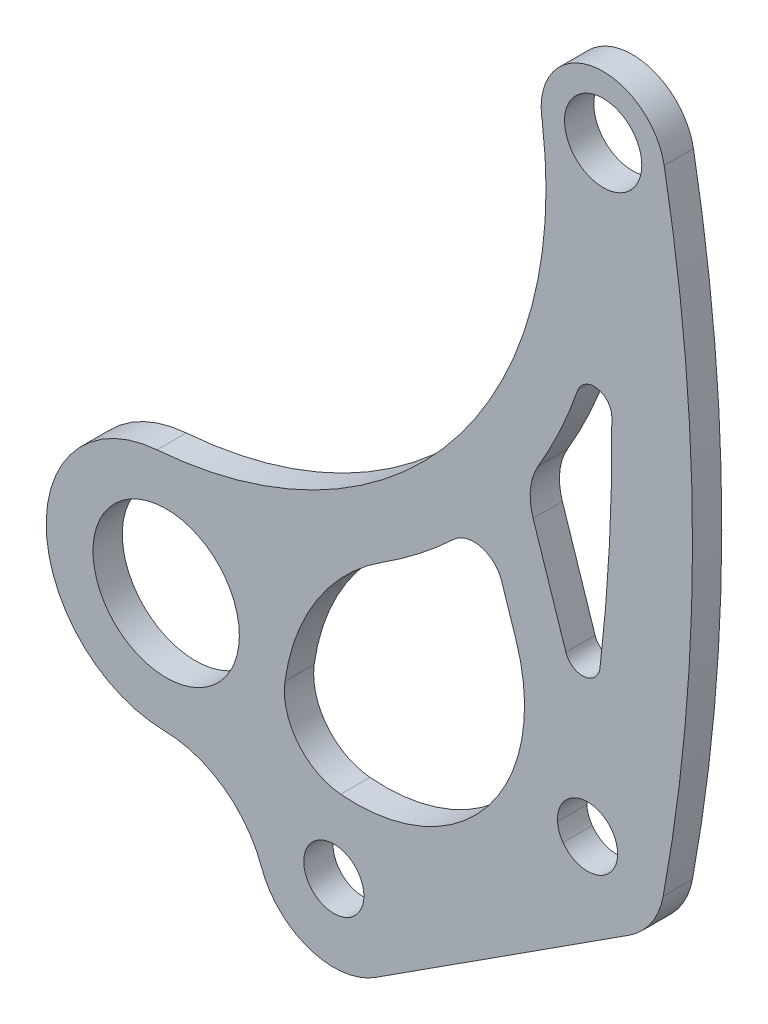
from build123d import *

# Parameters (mm, degrees)
SKETCH2_R           = 7.9375
SKETCH2_R_2         = 3.2639
SKETCH2_R_3         = 4.191
BOSS_EXTRUDE1_DEPTH = 3.175
FILLET3_R           = 1.905
FILLET4_R           = 6.35
BOSS_EXTRUDE2_START = -3.175
BOSS_EXTRUDE2_DEPTH = 3.175
CUT_EXTRUDE1_DEPTH  = 12.065
FILLET5_R           = 3.175
CUT_EXTRUDE2_DEPTH  = 93.540316773


with BuildPart() as part:
    # Sketch2 → Boss-Extrude1 (new body)
    with BuildSketch(Plane.XY):
        with BuildLine():
            Line((22.709173353, -24.74146542), (50.237344688, -7.01528789))
            ThreePointArc((50.237344688, -7.01528789), (52.649254226, -4.648236557), (53.924522204, -1.51871084))
            ThreePointArc((53.924522204, -1.51871084), (57.106411985, 32.846575037), (54.035830718, 67.22198524))
            ThreePointArc((54.035830718, 67.22198524), (46.044632155, 72.608660166), (40.859194914, 64.485436554))
            Line((40.859194914, 64.485436554), (40.833827284, 64.453346951))
            ThreePointArc((40.833827284, 64.453346951), (30.975387354, 29.729811242), (-0.998479041, 12.979150429))
            ThreePointArc((-0.998479041, 12.979150429), (-12.595568055, 3.287395871), (-7.214067166, -10.835706769))
            Line((-7.214067166, -10.835706769), (13.567787564, -24.671601284))
            ThreePointArc((13.567787564, -24.671601284), (18.128061271, -26.069833859), (22.709173353, -24.74146542))
        make_face()
        Circle(SKETCH2_R, mode=Mode.SUBTRACT)
        with Locations((18.191828664, -17.726177531)):
            Circle(SKETCH2_R_2, mode=Mode.SUBTRACT)
        with Locations((45.72, 0)):
            Circle(SKETCH2_R_2, mode=Mode.SUBTRACT)
        with BuildLine():
            Line((40.584986991, 6.617553577), (21.318666843, -5.788581474))
            Line((21.318666843, -5.788581474), (11.074870198, -6.841239387))
            ThreePointArc((11.074870198, -6.841239387), (12.976194182, 1.036190528), (9.848859751, 8.512066016))
            ThreePointArc((9.848859751, 8.512066016), (23.445327069, 14.632175726), (34.749899024, 24.354640398))
            Line((34.749899024, 24.354640398), (40.584986991, 6.617553577))
        make_face(mode=Mode.SUBTRACT)
        with BuildLine():
            ThreePointArc((47.523781163, 56.501393309), (48.257752726, 32.370804269), (45.933946154, 8.34115665))
            Line((45.933946154, 8.34115665), (38.882442516, 29.775817606))
            ThreePointArc((38.882442516, 29.775817606), (45.039190515, 42.544935267), (47.523781163, 56.501393309))
        make_face(mode=Mode.SUBTRACT)
        with Locations((47.413333333, 66.018287029)):
            Circle(SKETCH2_R_3, mode=Mode.SUBTRACT)
    extrude(amount=BOSS_EXTRUDE1_DEPTH)

    # Fillet3
    fillet3_edges = [part.edges().sort_by_distance(p)[0] for p in [
        (45.933946154, 8.34115665, 1.5875),
        (47.523781163, 56.501393309, 1.5875),
    ]]
    fillet(fillet3_edges, radius=FILLET3_R)

    # Fillet4
    fillet4_edges = [part.edges().sort_by_distance(p)[0] for p in [
        (38.882442516, 29.775817606, 1.5875),
    ]]
    fillet(fillet4_edges, radius=FILLET4_R)

    # Sketch3 → Boss-Extrude2 (add)
    with BuildSketch(Plane.XY.offset(3.175).offset(BOSS_EXTRUDE2_START)):
        with BuildLine():
            ThreePointArc((37.967247274, 14.574773228), (38.850624387, 9.974362656), (38.539279751, 5.300264126))
            Line((38.539279751, 5.300264126), (40.584986991, 6.617553577))
            Line((40.584986991, 6.617553577), (37.967247274, 14.574773228))
        make_face()
        with BuildLine():
            ThreePointArc((14.005375904, -6.540099084), (13.004272705, -4.28056917), (12.890798124, -1.811802966))
            ThreePointArc((12.890798124, -1.811802966), (12.243860592, -4.42076736), (11.074870198, -6.841239387))
            Line((11.074870198, -6.841239387), (14.005375904, -6.540099084))
        make_face()
        with BuildLine():
            ThreePointArc((9.848859751, 8.512066016), (12.486736073, 3.679229335), (12.890798124, -1.811802966))
            ThreePointArc((12.890798124, -1.811802966), (16.379474961, 7.582660649), (23.480082515, 14.654307207))
            ThreePointArc((23.480082515, 14.654307207), (16.886076234, 11.091387544), (9.848859751, 8.512066016))
        make_face()
    extrude(amount=BOSS_EXTRUDE2_DEPTH)

    # Sketch4 → Cut-Extrude1 (cut)
    with BuildSketch(Plane.XY):
        with BuildLine():
            Line((38.539279751, 5.300264126), (24.727997063, 1.47053375))
            ThreePointArc((24.727997063, 1.47053375), (25.836206507, -0.508508416), (26.220294441, -2.743953008))
            ThreePointArc((26.220294441, -2.743953008), (24.044282761, -7.68479904), (18.930249644, -9.41501626))
            ThreePointArc((18.930249644, -9.41501626), (30.477911362, -6.56779892), (37.848176473, 2.766778194))
            ThreePointArc((37.848176473, 2.766778194), (38.239149826, 4.021130685), (38.539279751, 5.300264126))
        make_face()
        with BuildLine():
            ThreePointArc((24.727997063, 1.47053375), (17.733373474, 3.709866579), (12.890798123, -1.811802972))
            Line((12.890798123, -1.811802972), (24.727997063, 1.47053375))
        make_face()
        with BuildLine():
            Line((24.727997063, 1.47053375), (12.890798123, -1.811802972))
            ThreePointArc((12.890798123, -1.811802972), (14.27873169, -6.909589201), (18.930249644, -9.41501626))
            ThreePointArc((18.930249644, -9.41501626), (24.044282761, -7.68479904), (26.220294441, -2.743953008))
            ThreePointArc((26.220294441, -2.743953008), (25.836206507, -0.508508416), (24.727997063, 1.47053375))
        make_face()
    extrude(amount=CUT_EXTRUDE1_DEPTH, mode=Mode.SUBTRACT)

    # Fillet5
    fillet5_edges = [part.edges().sort_by_distance(p)[0] for p in [
        (34.749899024, 24.354640398, 1.5875),
    ]]
    fillet(fillet5_edges, radius=FILLET5_R)

    # Sketch5 → Cut-Extrude2 (cut, through all)
    with BuildSketch(Plane.XY.offset(3.175)):
        with BuildLine():
            Line((-7.214067166, -10.835706769), (-15.113040322, -22.700159224))
            Line((-15.113040322, -22.700159224), (13.567787564, -34.649979512))
            Line((13.567787564, -34.649979512), (13.567787564, -24.671601284))
            ThreePointArc((13.567787564, -24.671601284), (11.621320872, -22.869045851), (10.339065437, -20.546598936))
            ThreePointArc((10.339065437, -20.546598936), (6.247008791, -15.136046815), (-0.196937719, -13.01601021))
            ThreePointArc((-0.196937719, -13.01601021), (-3.862535324, -12.431256056), (-7.214067166, -10.835706769))
        make_face()
    extrude(amount=-CUT_EXTRUDE2_DEPTH, mode=Mode.SUBTRACT)


solid = part.part
